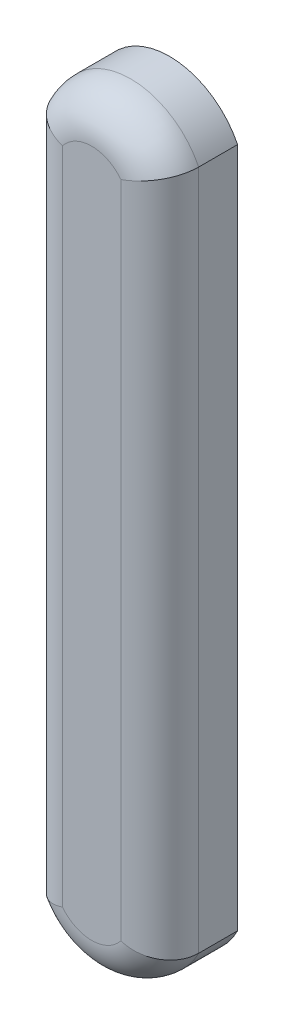
from build123d import *

# Parameters (mm, degrees)
BOSS_EXTRU_1_DEPTH = 0.2
CONG_1_R           = 0.1


with BuildPart() as part:
    # Esquisse1 → Boss.-Extru.1 (new body)
    with BuildSketch(Plane.XY):
        with BuildLine():
            Line((0, 0), (0, 1.75))
            ThreePointArc((0, 1.75), (0.175, 1.859006611), (0.35, 1.75))
            Line((0.35, 1.75), (0.35, 0))
            ThreePointArc((0.35, 0), (0.175, -0.109006611), (0, 0))
        make_face()
    extrude(amount=BOSS_EXTRU_1_DEPTH)

    # Congé1
    cong_1_edges = [part.edges().sort_by_distance(p)[0] for p in [
        (0.175, 1.859006611, 0.2),
        (0, 0.875, 0.2),
        (0.175, -0.109006611, 0.2),
        (0.35, 0.875, 0.2),
    ]]
    fillet(cong_1_edges, radius=CONG_1_R)


solid = part.part
